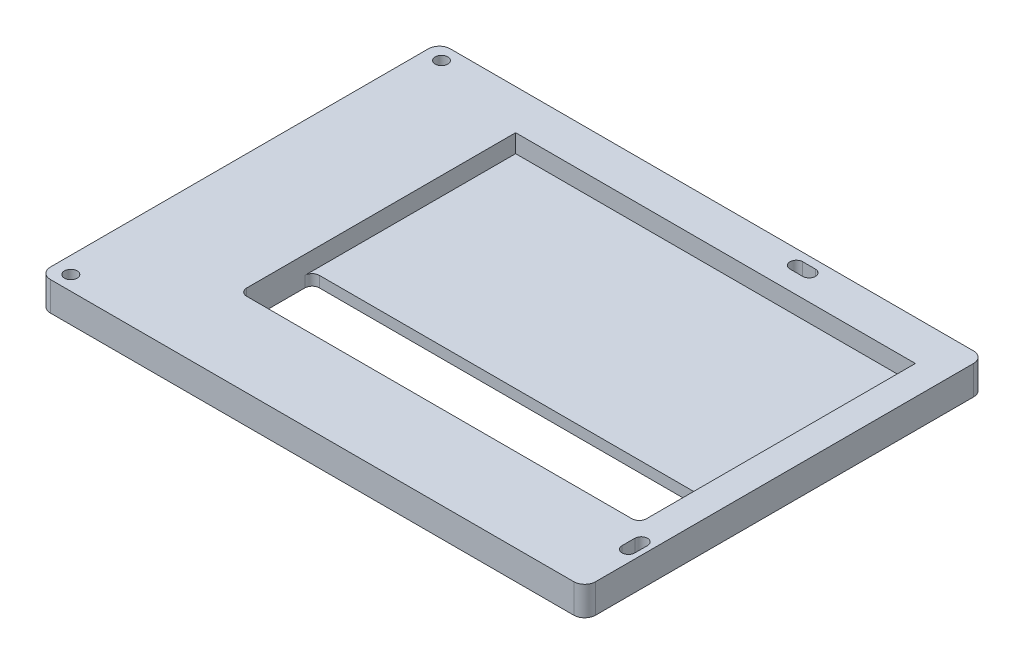
from build123d import *

# Parameters (mm, degrees)
SKETCH_1_W          = 150
SKETCH_1_H          = 110
EXTRUDE_1_DEPTH     = 8
SKETCH_2_R          = 1.75
CUT_EXTRUDE_1_DEPTH = 187.182705964
CUT_EXTRUDE_2_DEPTH = 187.182705964
SKETCH_4_W          = 110
SKETCH_4_H          = 20
CUT_EXTRUDE_3_DEPTH = 187.182705964
SKETCH_5_W          = 110
SKETCH_5_H          = 76
CUT_EXTRUDE_4_DEPTH = 5
FILLET_1_R          = 2
FILLET_2_R          = 3


with BuildPart() as part:
    # 草图1 → 凸台-拉伸1 (new body)
    with BuildSketch(Plane(origin=(0, 0, 0), x_dir=(1, 0, 0), z_dir=(0, 1, 0))):
        with Locations((75, 55)):
            Rectangle(SKETCH_1_W, SKETCH_1_H)
    extrude(amount=EXTRUDE_1_DEPTH)

    # 草图2 → 切除-拉伸1 (cut, through all)
    with BuildSketch(Plane(origin=(0, 8, 0), x_dir=(1, 0, 0), z_dir=(0, 1, 0))):
        with Locations(Location((4.6, 106, 0), (0, 0, 270))):
            Circle(SKETCH_2_R)
        with Locations(Location((4.6, 4, 0), (0, 0, 270))):
            Circle(SKETCH_2_R)
        with Locations(Location((104, 106, 0), (0, 0, 270))):
            Circle(SKETCH_2_R)
        with Locations(Location((146.8, 17, 0), (0, 0, 270))):
            Circle(SKETCH_2_R)
    extrude(amount=-CUT_EXTRUDE_1_DEPTH, mode=Mode.SUBTRACT)

    # 草图3 → 切除-拉伸2 (cut, through all)
    with BuildSketch(Plane(origin=(0, 8, 0), x_dir=(1, 0, 0), z_dir=(0, 1, 0))):
        with BuildLine():
            Line((102.25, 107.75), (105.75, 107.75))
            ThreePointArc((105.75, 107.75), (107.5, 106), (105.75, 104.25))
            Line((105.75, 104.25), (102.25, 104.25))
            ThreePointArc((102.25, 104.25), (100.5, 106), (102.25, 107.75))
        make_face()
        with BuildLine():
            Line((145.05, 15.25), (145.05, 18.75))
            ThreePointArc((145.05, 18.75), (146.8, 20.5), (148.55, 18.75))
            Line((148.55, 18.75), (148.55, 15.25))
            ThreePointArc((148.55, 15.25), (146.8, 13.5), (145.05, 15.25))
        make_face()
    extrude(amount=-CUT_EXTRUDE_2_DEPTH, mode=Mode.SUBTRACT)

    # 草图4 → 切除-拉伸3 (cut, through all)
    with BuildSketch(Plane(origin=(0, 8, 0), x_dir=(1, 0, 0), z_dir=(0, 1, 0))):
        with Locations((87, 33)):
            Rectangle(SKETCH_4_W, SKETCH_4_H)
    extrude(amount=-CUT_EXTRUDE_3_DEPTH, mode=Mode.SUBTRACT)

    # 草图5 → 切除-拉伸4 (cut)
    with BuildSketch(Plane(origin=(0, 8, 0), x_dir=(1, 0, 0), z_dir=(0, 1, 0))):
        with Locations((87, 61)):
            Rectangle(SKETCH_5_W, SKETCH_5_H)
    extrude(amount=-CUT_EXTRUDE_4_DEPTH, mode=Mode.SUBTRACT)

    # 圆角1
    fillet_1_edges = [part.edges().sort_by_distance(p)[0] for p in [
        (32, 4, -23),
        (32, 1.5, -43),
        (142, 1.5, -43),
        (142, 4, -23),
    ]]
    fillet(fillet_1_edges, radius=FILLET_1_R)

    # 圆角2
    fillet_2_edges = [part.edges().sort_by_distance(p)[0] for p in [
        (0, 4, -110),
        (150, 4, -110),
        (150, 4, 0),
        (0, 4, 0),
    ]]
    fillet(fillet_2_edges, radius=FILLET_2_R)


solid = part.part
